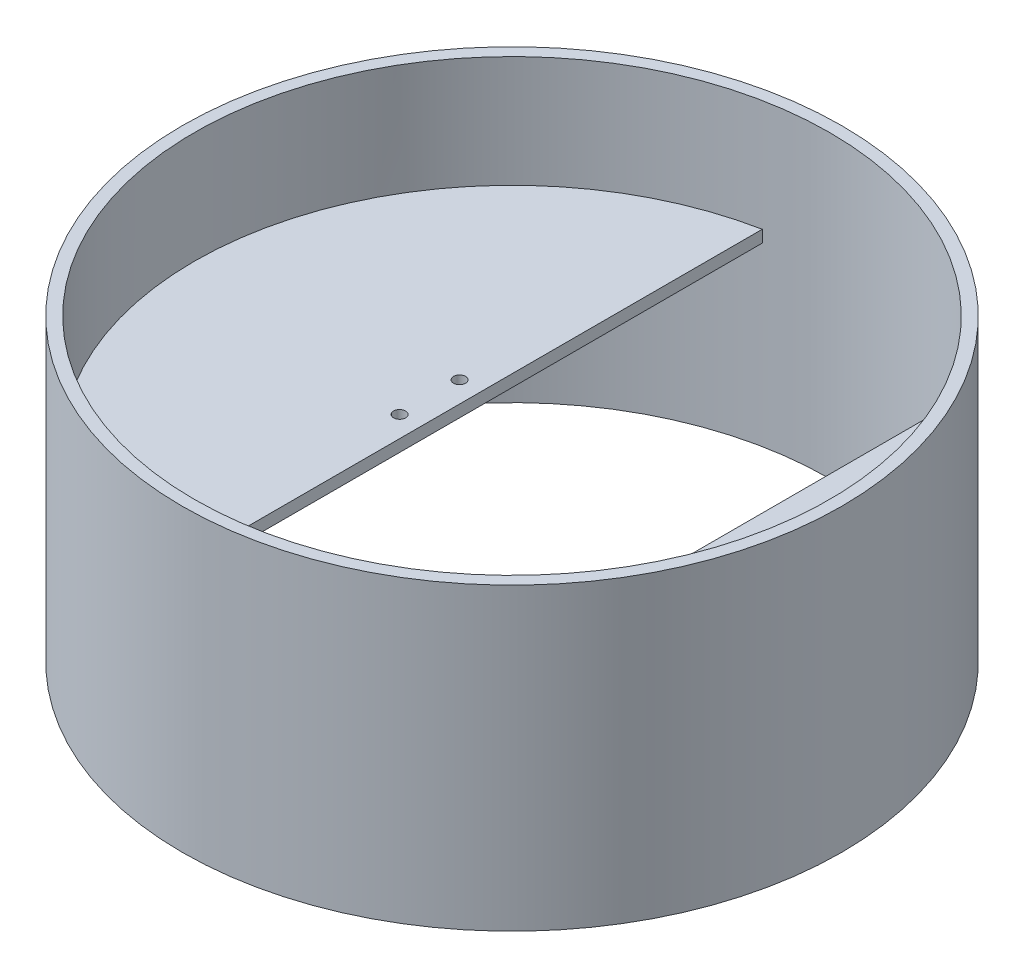
from build123d import *

# Parameters (mm, degrees)
SKETCH1_R           = 55
SKETCH1_R_2         = 53
BOSS_EXTRUDE1_DEPTH = 50
RIB7_REACH          = 85.881
SKETCH2_WALL_W      = 256.096361878
SKETCH2_WALL_H      = 2
RIB8_REACH          = 85.881
SKETCH5_WALL_W      = 103.99879807
SKETCH5_WALL_H      = 2
SKETCH6_R           = 1
CUT_EXTRUDE1_DEPTH  = 84.880629468


with BuildPart() as part:
    # Sketch1 → Boss-Extrude1 (new body)
    with BuildSketch(Plane(origin=(0, 0, 0), x_dir=(1, 0, 0), z_dir=(0, 1, 0))):
        with Locations(Location((0, 0, 0), (0, 0, 270))):
            Circle(SKETCH1_R)
        with Locations(Location((0, 0, 0), (0, 0, 270))):
            Circle(SKETCH1_R_2, mode=Mode.SUBTRACT)
    extrude(amount=BOSS_EXTRUDE1_DEPTH)

    # Sketch2 wall → Rib7 (add, up to next)
    with BuildSketch(Plane(origin=(30.75, 31.4, 0), x_dir=(0, 0, 1), z_dir=(1, 0, 0)), mode=Mode.PRIVATE) as rib7_sk1:
        with Locations((0, 1)):
            Rectangle(SKETCH2_WALL_W, SKETCH2_WALL_H)
    rib7_tool1 = extrude(rib7_sk1.sketch, amount=RIB7_REACH, mode=Mode.PRIVATE) - part.part
    add(rib7_tool1.solids().sort_by_distance((30.75, 31.4, 0))[0])

    # Sketch5 wall → Rib8 (add, up to next)
    with BuildSketch(Plane(origin=(-10.25, 31.4, 0), x_dir=(0, 0, 1), z_dir=(1, 0, 0)), mode=Mode.PRIVATE) as rib8_sk1:
        with Locations((0, 1)):
            Rectangle(SKETCH5_WALL_W, SKETCH5_WALL_H)
    rib8_tool1 = extrude(rib8_sk1.sketch, amount=-RIB8_REACH, mode=Mode.PRIVATE) - part.part
    add(rib8_tool1.solids().sort_by_distance((-10.25, 31.4, 0))[0])

    # Sketch6 → Cut-Extrude1 (cut, through all)
    with BuildSketch(Plane(origin=(0, 31.4, 0), x_dir=(1, 0, 0), z_dir=(0, 1, 0))):
        with Locations(Location((-13.75, -5, 0), (0, 0, 270))):
            Circle(SKETCH6_R)
        with Locations(Location((34.25, -5, 0), (0, 0, 270))):
            Circle(SKETCH6_R)
        with Locations(Location((34.25, 5, 0), (0, 0, 270))):
            Circle(SKETCH6_R)
        with Locations(Location((-13.75, 5, 0), (0, 0, 270))):
            Circle(SKETCH6_R)
    extrude(amount=-CUT_EXTRUDE1_DEPTH, mode=Mode.SUBTRACT)


solid = part.part
